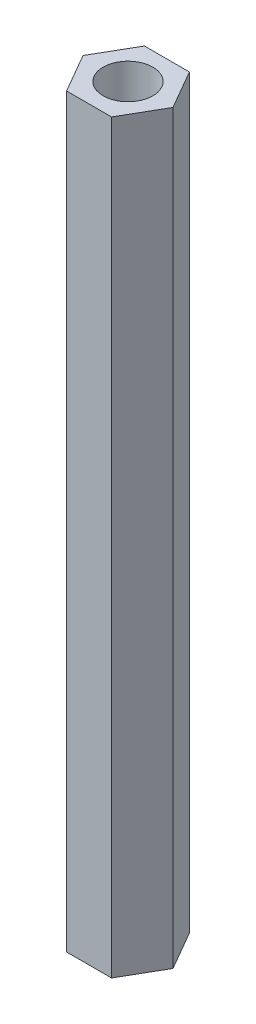
from build123d import *

# Parameters (mm, degrees)
SKETCH1_R           = 1.5
BOSS_EXTRUDE1_DEPTH = 45


with BuildPart() as part:
    # Sketch1 → Boss-Extrude1 (new body)
    with BuildSketch(Plane(origin=(0, 0, 0), x_dir=(1, 0, 0), z_dir=(0, 1, 0))):
        Polygon((2.713546265, 0), (1.356773133, 2.35), (-1.356773133, 2.35), (-2.713546265, 0), (-1.356773133, -2.35), (1.356773133, -2.35), align=None)
        with Locations(Location((0, 0, 0), (0, 0, 90))):
            Circle(SKETCH1_R, mode=Mode.SUBTRACT)
    extrude(amount=BOSS_EXTRUDE1_DEPTH)


solid = part.part
